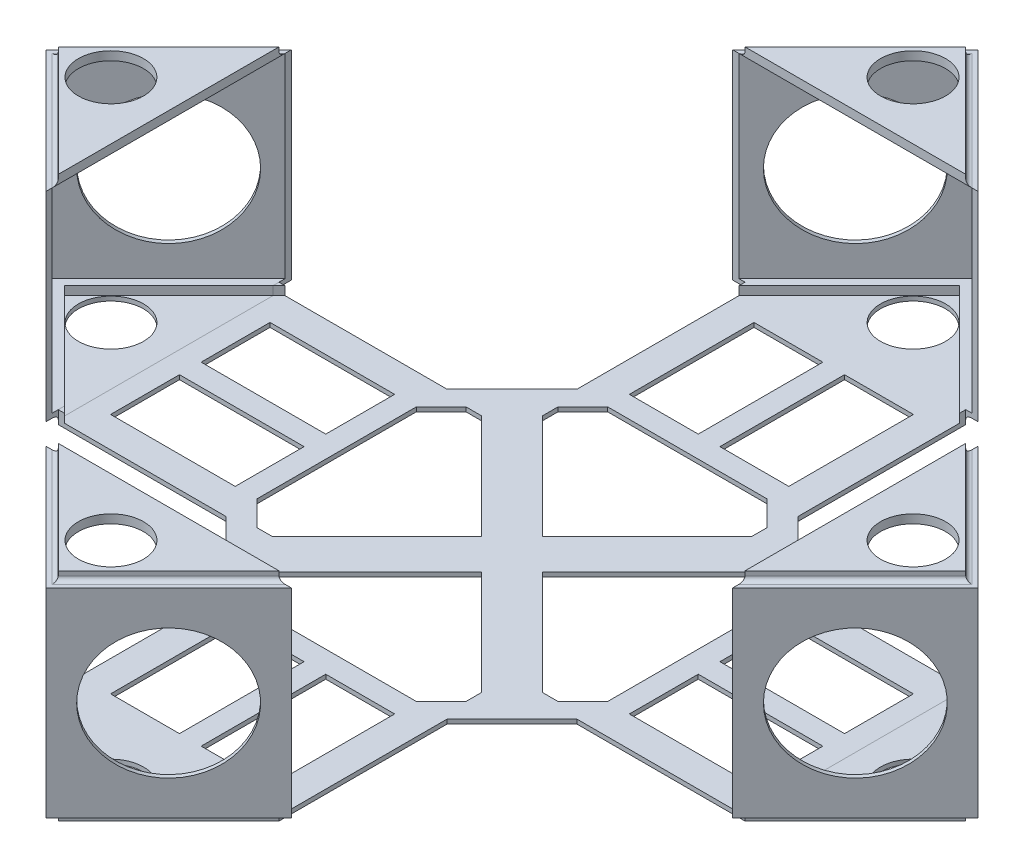
from build123d import *

# Parameters (mm, degrees)
SKETCH_1_R               = 15
EXTRUDE_1_DEPTH          = 50
EXTRUDE_1_2_DEPTH        = 50
CUT_EXTRUDE_1_DEPTH      = 4
FILLET_1_R               = 2
FILLET_2_R               = 2
PATTERN_CIRCULAR_1_COUNT = 2
PATTERN_CIRCULAR_1_ANGLE = 90
PATTERN_CIRCULAR_2_COUNT = 2
PATTERN_CIRCULAR_2_ANGLE = 90
SKETCH_4_W               = 57.480230741
SKETCH_4_H               = 31.769552622
SKETCH_4_W_2             = 31.769552622
SKETCH_4_H_2             = 57.480230741
EXTRUDE_2_DEPTH          = 6
CUT_EXTRUDE_2_DEPTH      = 90
SKETCH_7_R               = 30
CUT_EXTRUDE_3_DEPTH      = 459.733037834
PATTERN_CIRCULAR_3_COUNT = 2
PATTERN_CIRCULAR_3_ANGLE = 90
CUT_EXTRUDE_4_DEPTH      = 4


with BuildPart() as part:
    # 草圖1 → 填料-伸長1 (new, symmetric)
    with BuildSketch(Plane(origin=(0, 0, 0), x_dir=(1, 0, 0), z_dir=(0, 1, 0))):
        Polygon((-158.391918986, 56.568542495), (-214.960461481, 0), (-158.391918986, -56.568542495), align=None)
        with Locations(Location((-185, 0, 0), (0, 0, 270))):
            Circle(SKETCH_1_R, mode=Mode.SUBTRACT)
    extrude(amount=EXTRUDE_1_DEPTH, both=True)


with BuildPart() as body_2:
    # 草圖1 → Extrude 1 2 (new, symmetric)
    with BuildSketch(Plane(origin=(0, 0, 0), x_dir=(1, 0, 0), z_dir=(0, 1, 0))):
        Polygon((158.391918986, 56.568542495), (214.960461481, 0), (158.391918986, -56.568542495), align=None)
        with Locations(Location((185, 0, 0), (0, 0, 270))):
            Circle(SKETCH_1_R, mode=Mode.SUBTRACT)
    extrude(amount=EXTRUDE_1_2_DEPTH, both=True)


with BuildPart() as cut_extrude_1_tool:
    # 草圖2 → 除料-伸長1 (new body)
    with BuildSketch(Plane(origin=(0, 50, 0), x_dir=(1, 0, 0), z_dir=(0, 1, 0))):
        Polygon((-214.960461481, 0), (-158.391918986, -56.568542495), (-155.563491861, -53.74011537), (-209.303607231, 0), (-155.563491861, 53.74011537), (-158.391918986, 56.568542495), align=None)
        Polygon((214.960461481, 0), (158.391918986, -56.568542495), (155.563491861, -53.74011537), (209.303607231, 0), (155.563491861, 53.74011537), (158.391918986, 56.568542495), align=None)
    cut_extrude_1 = extrude(amount=-CUT_EXTRUDE_1_DEPTH)


with BuildPart() as part_1:
    add(part.part)

    # 除料-伸長1: cut by cut_extrude_1_tool
    add(cut_extrude_1_tool.part, mode=Mode.SUBTRACT)


with BuildPart() as body_2_1:
    add(body_2.part)

    # 除料-伸長1: cut by cut_extrude_1_tool
    add(cut_extrude_1_tool.part, mode=Mode.SUBTRACT)


with BuildPart() as mirror_2_tool:
    # 鏡射2: 除料-伸長1 across plane
    add(cut_extrude_1.mirror(Plane.ZX))


with BuildPart() as part_2:
    add(part_1.part)

    # 鏡射2: cut by mirror_2_tool
    add(mirror_2_tool.part, mode=Mode.SUBTRACT)

    # 圓角1
    fillet_1_edges = [part_2.edges().sort_by_distance(p)[0] for p in [
        (-183.847763109, 46, -25.455844123),
        (-183.847763109, 46, 25.455844123),
        (-183.847763109, -46, 25.455844123),
        (-183.847763109, -46, -25.455844123),
    ]]
    fillet(fillet_1_edges, radius=FILLET_1_R)


with BuildPart() as body_2_2:
    add(body_2_1.part)

    # 鏡射2: cut by mirror_2_tool
    add(mirror_2_tool.part, mode=Mode.SUBTRACT)

    # 圓角2
    fillet_2_edges = [body_2_2.edges().sort_by_distance(p)[0] for p in [
        (183.847763109, 46, 25.455844123),
        (183.847763109, 46, -25.455844123),
        (183.847763109, -46, -25.455844123),
        (183.847763109, -46, 25.455844123),
    ]]
    fillet(fillet_2_edges, radius=FILLET_2_R)


with BuildPart() as pattern_circular_1_1:
    # 環狀複製排列1: pattern copy
    add(part_2.part.rotate(Axis((0, 0, 0), (0, -1, 0)), 1 * PATTERN_CIRCULAR_1_ANGLE / (PATTERN_CIRCULAR_1_COUNT - 1)))



with BuildPart() as pattern_circular_2_1:
    # 環狀複製排列2: pattern copy
    add(part_2.part.rotate(Axis((0, 0, 0), (0, 1, 0)), 1 * PATTERN_CIRCULAR_2_ANGLE / (PATTERN_CIRCULAR_2_COUNT - 1)))


with BuildPart() as pattern_circular_1_1_1:
    add(pattern_circular_1_1.part)

    add(pattern_circular_2_1.part)  # 填料-伸長2 merges 環狀複製排列2_1
    # 草圖4 → 填料-伸長2 (add)
    with BuildSketch(Plane.XZ.offset(50)):
        Polygon((-50.911688245, 158.391918986), (-50.911688245, 80.911688245), (-80.911688245, 50.911688245), (-158.391918986, 50.911688245), (-158.391918986, -50.911688245), (-80.911688245, -50.911688245), (-50.911688245, -80.911688245), (-50.911688245, -158.391918986), (50.911688245, -158.391918986), (50.911688245, -80.911688245), (80.911688245, -50.911688245), (158.391918986, -50.911688245), (158.391918986, 50.911688245), (80.911688245, 50.911688245), (50.911688245, 80.911688245), (50.911688245, 158.391918986), align=None)
        Polygon((48.234018716, 62.376154339), (0, 14.142135624), (-48.234018716, 62.376154339), (-48.234018716, 69.447222151), (-36.769552622, 80.911688245), (36.769552622, 80.911688245), (48.234018716, 69.447222151), align=None, mode=Mode.SUBTRACT)
        Polygon((80.912688245, 36.770552622), (80.912688245, -36.768552622), (69.448222151, -48.233018716), (62.37715434, -48.233018716), (14.143135624, 0.001), (62.37715434, 48.235018716), (69.448222151, 48.235018716), align=None, mode=Mode.SUBTRACT)
        Polygon((36.771552622, -80.911688245), (-36.767552622, -80.911688245), (-48.232018716, -69.447222151), (-48.232018716, -62.37615434), (0.002, -14.142135624), (48.236018716, -62.37615434), (48.236018716, -69.447222151), align=None, mode=Mode.SUBTRACT)
        Polygon((-80.910688245, -36.770552622), (-80.910688245, 36.768552622), (-69.446222151, 48.233018716), (-62.375154339, 48.233018716), (-14.141135624, -0.001), (-62.375154339, -48.235018716), (-69.446222151, -48.235018716), align=None, mode=Mode.SUBTRACT)
        with Locations((119.651803616, -20.884776311)):
            Rectangle(SKETCH_4_W, SKETCH_4_H, mode=Mode.SUBTRACT)
        with Locations((20.884776311, 119.651803616)):
            Rectangle(SKETCH_4_W_2, SKETCH_4_H_2, mode=Mode.SUBTRACT)
        with Locations((-20.884776311, 119.651803616)):
            Rectangle(SKETCH_4_W_2, SKETCH_4_H_2, mode=Mode.SUBTRACT)
        with Locations((119.651803616, 20.884776311)):
            Rectangle(SKETCH_4_W, SKETCH_4_H, mode=Mode.SUBTRACT)
        with Locations((-20.884776311, -119.651803616)):
            Rectangle(SKETCH_4_W_2, SKETCH_4_H_2, mode=Mode.SUBTRACT)
        with Locations((20.884776311, -119.651803616)):
            Rectangle(SKETCH_4_W_2, SKETCH_4_H_2, mode=Mode.SUBTRACT)
        with Locations((-119.651803616, 20.884776311)):
            Rectangle(SKETCH_4_W, SKETCH_4_H, mode=Mode.SUBTRACT)
        with Locations((-119.651803616, -20.884776311)):
            Rectangle(SKETCH_4_W, SKETCH_4_H, mode=Mode.SUBTRACT)
    extrude(amount=-EXTRUDE_2_DEPTH)


with BuildPart() as cut_extrude_2_tool:
    # 草圖5 → 除料-伸長2 (new body)
    with BuildSketch(Plane(origin=(0, -44, 0), x_dir=(1, 0, 0), z_dir=(0, 1, 0))):
        Polygon((212.132034356, 0), (0, 212.132034356), (-212.132034356, 0), (0, -212.132034356), align=None)
    extrude(amount=CUT_EXTRUDE_2_DEPTH)


with BuildPart() as part_3:
    add(part_2.part)

    # 除料-伸長2: cut by cut_extrude_2_tool
    add(cut_extrude_2_tool.part, mode=Mode.SUBTRACT)


with BuildPart() as body_2_3:
    add(body_2_2.part)

    # 除料-伸長2: cut by cut_extrude_2_tool
    add(cut_extrude_2_tool.part, mode=Mode.SUBTRACT)


with BuildPart() as pattern_circular_1_1_2:
    add(pattern_circular_1_1_1.part)

    # 除料-伸長2: cut by cut_extrude_2_tool
    add(cut_extrude_2_tool.part, mode=Mode.SUBTRACT)


with BuildPart() as cut_extrude_2_piece_1:
    # of the separate pieces the step leaves, piece 1, a body of its own (cut_extrude_2_pieces)
    add(part_3.part.solids().sort_by_distance((-158.391918986, 46, -56.568542495))[0])


with BuildPart() as cut_extrude_2_piece_2:
    # of the separate pieces the step leaves, piece 2, a body of its own (cut_extrude_2_pieces)
    add(part_3.part.solids().sort_by_distance((-209.303607231, 48, 0))[0])


with BuildPart() as cut_extrude_2_piece_1_of_body_2:
    # of the separate pieces the step leaves, piece 1, a body of its own (cut_extrude_2_pieces_of_body_2)
    add(body_2_3.part.solids().sort_by_distance((158.391918986, -44, 53.74011537))[0])


with BuildPart() as cut_extrude_2_piece_2_of_body_2:
    # of the separate pieces the step leaves, piece 2, a body of its own (cut_extrude_2_pieces_of_body_2)
    add(body_2_3.part.solids().sort_by_distance((158.391918986, 48, 50.911688245))[0])


with BuildPart() as cut_extrude_2_piece_1_of_pattern_circula:
    # of the separate pieces the step leaves, piece 1, a body of its own (cut_extrude_2_pieces_of_pattern_circular)
    add(pattern_circular_1_1_2.part.solids().sort_by_distance((-56.568542495, 46, 158.391918986))[0])


with BuildPart() as cut_extrude_2_piece_2_of_pattern_circula:
    # of the separate pieces the step leaves, piece 2, a body of its own (cut_extrude_2_pieces_of_pattern_circular)
    add(pattern_circular_1_1_2.part.solids().sort_by_distance((0, 48, 209.303607231))[0])


with BuildPart() as cut_extrude_2_piece_3_of_pattern_circula:
    # of the separate pieces the step leaves, piece 3, a body of its own (cut_extrude_2_pieces_of_pattern_circular)
    add(pattern_circular_1_1_2.part.solids().sort_by_distance((-50.911688245, 48, -158.391918986))[0])


with BuildPart() as cut_extrude_3_tool:
    # 草圖7 → 除料-伸長3 (new, through all)
    with BuildSketch(Plane(origin=(-107.48023074, 0, -107.48023074), x_dir=(-0.7071067811865502, 0, 0.7071067811865449), z_dir=(-0.7071067811865449, 0, -0.7071067811865502))):
        with Locations((-112, 0)):
            Circle(SKETCH_7_R)
        with Locations((112, 0)):
            Circle(SKETCH_7_R)
    cut_extrude_3 = extrude(amount=-CUT_EXTRUDE_3_DEPTH)


with BuildPart() as cut_extrude_2_piece_1_1:
    add(cut_extrude_2_piece_1.part)

    # 除料-伸長3: cut by cut_extrude_3_tool
    add(cut_extrude_3_tool.part, mode=Mode.SUBTRACT)


with BuildPart() as cut_extrude_2_piece_1_of_body_2_1:
    add(cut_extrude_2_piece_1_of_body_2.part)

    # 除料-伸長3: cut by cut_extrude_3_tool
    add(cut_extrude_3_tool.part, mode=Mode.SUBTRACT)


with BuildPart() as cut_extrude_2_piece_1_of_pattern_circula_1:
    add(cut_extrude_2_piece_1_of_pattern_circula.part)

    # 除料-伸長3: cut by cut_extrude_3_tool
    add(cut_extrude_3_tool.part, mode=Mode.SUBTRACT)


with BuildPart() as pattern_circular_3_tool:
    # 環狀複製排列3: 除料-伸長3 ×2 about axis
    pattern_circular_3_axis = Axis((0, 0, 0), (0, 1, 0))
    for i in range(1, PATTERN_CIRCULAR_3_COUNT):
        add(cut_extrude_3.rotate(pattern_circular_3_axis, i * PATTERN_CIRCULAR_3_ANGLE / (PATTERN_CIRCULAR_3_COUNT - 1)))


with BuildPart() as cut_extrude_2_piece_1_2:
    add(cut_extrude_2_piece_1_1.part)

    # 環狀複製排列3: cut by pattern_circular_3_tool
    add(pattern_circular_3_tool.part, mode=Mode.SUBTRACT)


with BuildPart() as cut_extrude_2_piece_1_of_body_2_2:
    add(cut_extrude_2_piece_1_of_body_2_1.part)

    # 環狀複製排列3: cut by pattern_circular_3_tool
    add(pattern_circular_3_tool.part, mode=Mode.SUBTRACT)


with BuildPart() as cut_extrude_2_piece_1_of_pattern_circula_2:
    add(cut_extrude_2_piece_1_of_pattern_circula_1.part)

    # 環狀複製排列3: cut by pattern_circular_3_tool
    add(pattern_circular_3_tool.part, mode=Mode.SUBTRACT)


with BuildPart() as cut_extrude_4_tool:
    # 草圖8 → 除料-伸長4 (new body)
    with BuildSketch(Plane(origin=(0, -44, 0), x_dir=(1, 0, 0), z_dir=(0, 1, 0))):
        Polygon((206.475180106, 0), (0, 206.475180106), (-206.475180106, 0), (0, -206.475180106), align=None)
    extrude(amount=-CUT_EXTRUDE_4_DEPTH)


with BuildPart() as cut_extrude_2_piece_1_3:
    add(cut_extrude_2_piece_1_2.part)

    # 除料-伸長4: cut by cut_extrude_4_tool
    add(cut_extrude_4_tool.part, mode=Mode.SUBTRACT)


with BuildPart() as cut_extrude_2_piece_1_of_body_2_3:
    add(cut_extrude_2_piece_1_of_body_2_2.part)

    # 除料-伸長4: cut by cut_extrude_4_tool
    add(cut_extrude_4_tool.part, mode=Mode.SUBTRACT)


with BuildPart() as cut_extrude_2_piece_1_of_pattern_circula_3:
    add(cut_extrude_2_piece_1_of_pattern_circula_2.part)

    # 除料-伸長4: cut by cut_extrude_4_tool
    add(cut_extrude_4_tool.part, mode=Mode.SUBTRACT)


solid = Compound([cut_extrude_2_piece_2.part, cut_extrude_2_piece_2_of_body_2.part, cut_extrude_2_piece_2_of_pattern_circula.part, cut_extrude_2_piece_3_of_pattern_circula.part, cut_extrude_2_piece_1_3.part, cut_extrude_2_piece_1_of_body_2_3.part, cut_extrude_2_piece_1_of_pattern_circula_3.part])
